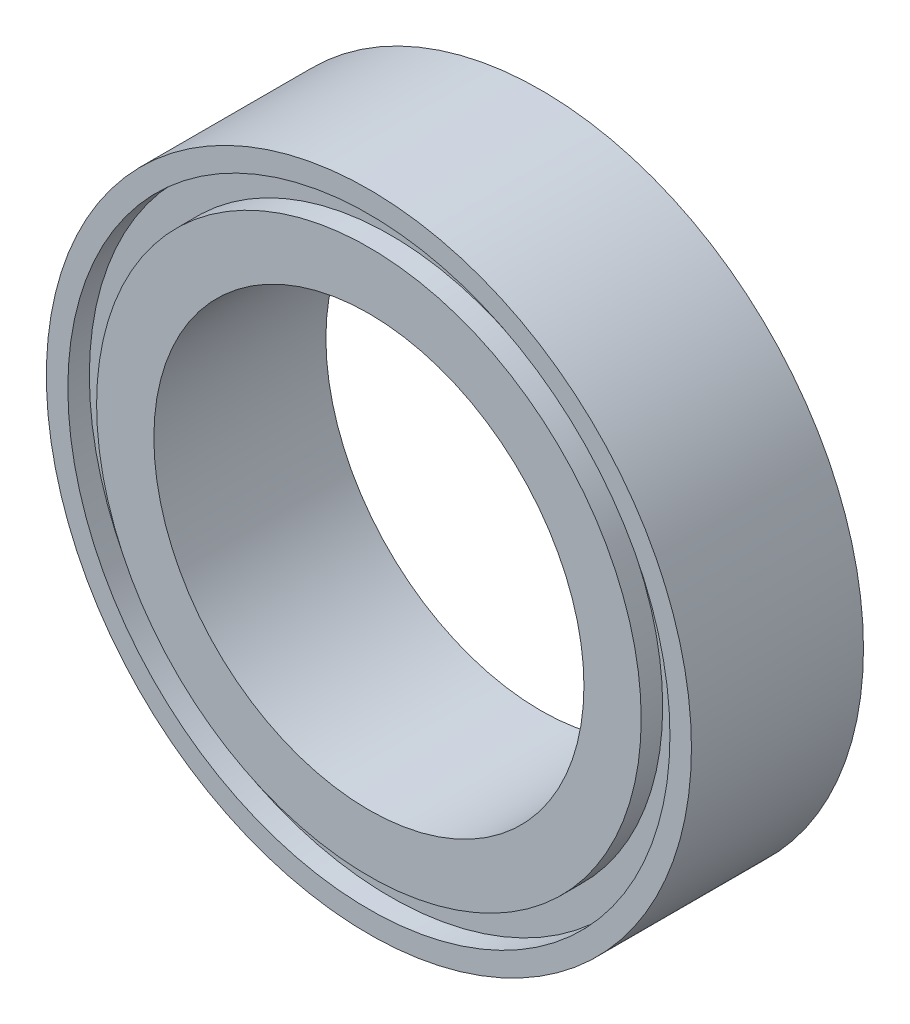
from build123d import *

# Parameters (mm, degrees)
SKETCH1_R           = 7.5
SKETCH1_R_2         = 5
BOSS_EXTRUDE1_DEPTH = 2
SKETCH2_R           = 7
SKETCH2_R_2         = 6.331589602
CUT_EXTRUDE1_DEPTH  = 0.5


with BuildPart() as part:
    # Sketch1 → Boss-Extrude1 (new, symmetric)
    with BuildSketch(Plane.XY):
        Circle(SKETCH1_R)
        Circle(SKETCH1_R_2, mode=Mode.SUBTRACT)
    extrude(amount=BOSS_EXTRUDE1_DEPTH, both=True)

    # Sketch2 → Cut-Extrude1 (cut)
    with BuildSketch(Plane.XY.offset(2)):
        Circle(SKETCH2_R)
        Circle(SKETCH2_R_2, mode=Mode.SUBTRACT)
    cut_extrude1 = extrude(amount=-CUT_EXTRUDE1_DEPTH, mode=Mode.SUBTRACT)

    # Mirror1: Cut-Extrude1 across plane
    add(cut_extrude1.mirror(Plane.XY), mode=Mode.SUBTRACT)


solid = part.part
